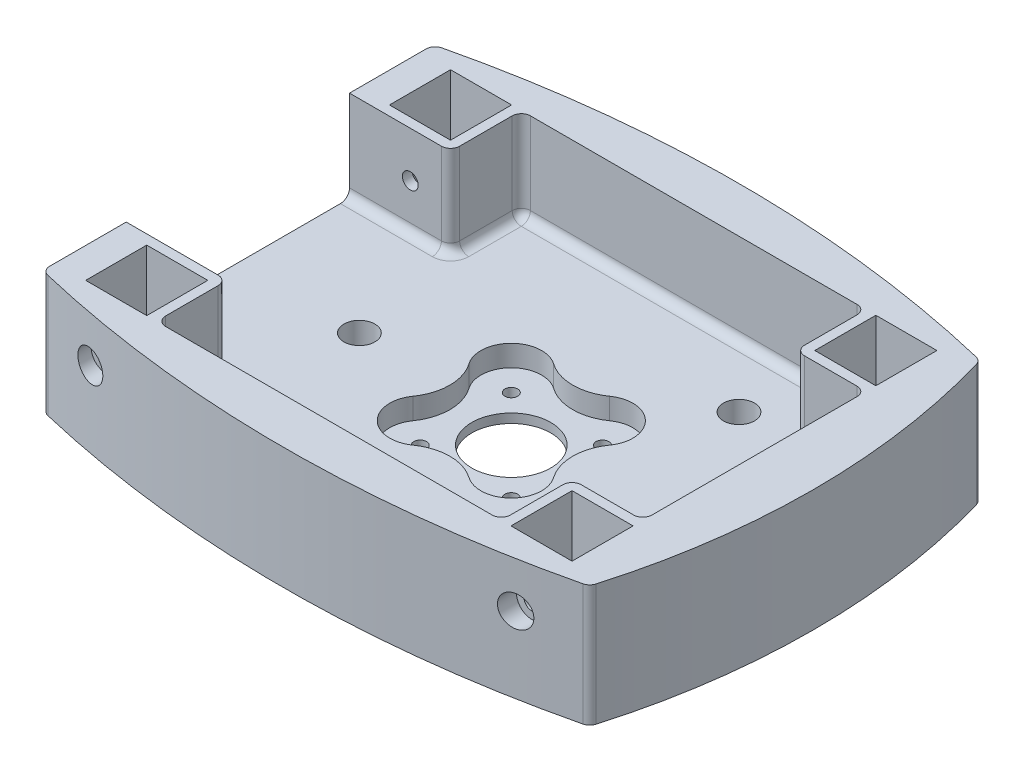
from build123d import *

# Parameters (mm, degrees)
SKETCH1_W           = 20.1
SKETCH1_H           = 20.1
BOSS_EXTRUDE1_DEPTH = 40
SKETCH1_3_R         = 5.1
BOSS_EXTRUDE2_DEPTH = 10
SKETCH1_4_R         = 13
SKETCH1_4_R_2       = 2.1
BOSS_EXTRUDE3_DEPTH = 3
SKETCH2_R           = 5.05
CUT_EXTRUDE1_DEPTH  = 62
SKETCH2_3_R         = 5.05
SKETCH2_3_R_2       = 2.6
BOSS_EXTRUDE5_DEPTH = 26.5
SKETCH2_4_R         = 5.05
SKETCH2_4_R_2       = 2.6
CUT_EXTRUDE2_DEPTH  = 23.3
SKETCH2_5_R         = 5.05
SKETCH2_5_R_2       = 2.6
BOSS_EXTRUDE6_DEPTH = 3.2
CUT_EXTRUDE3_START  = 127.2
SKETCH2_6_R         = 5.05
CUT_EXTRUDE3_DEPTH  = 127.2
BOSS_EXTRUDE7_START = 100
SKETCH2_7_R         = 5.05
SKETCH2_7_R_2       = 2.6
BOSS_EXTRUDE7_DEPTH = 100
CUT_EXTRUDE4_START  = 96.8
SKETCH2_8_R         = 5.05
SKETCH2_8_R_2       = 2.6
CUT_EXTRUDE4_DEPTH  = 96.8
BOSS_EXTRUDE8_START = 76.7
SKETCH2_9_R         = 5.05
SKETCH2_9_R_2       = 2.6
BOSS_EXTRUDE8_DEPTH = 76.7
CUT_EXTRUDE5_START  = 73.5
SKETCH2_10_R        = 5.05
SKETCH2_10_R_2      = 2.6
CUT_EXTRUDE5_DEPTH  = 73.5
SKETCH3_W           = 73.5
SKETCH3_H           = 30
CUT_EXTRUDE6_DEPTH  = 10
FILLET1_R           = 3


with BuildPart() as part:
    # Sketch1 → Boss-Extrude1 (new body)
    with BuildSketch(Plane(origin=(0, 0, 0), x_dir=(1, 0, 0), z_dir=(0, 1, 0))):
        with BuildLine():
            Line((-160, 14.285714286), (-160, -114.285714286))
            ThreePointArc((-160, -114.285714286), (-70, -125.097415446), (20, -114.285714286))
            ThreePointArc((20, -114.285714286), (29.379159313, -50), (20, 14.285714286))
            ThreePointArc((20, 14.285714286), (-70, 25.097415446), (-160, 14.285714286))
        make_face()
        with Locations((-140, 0)):
            Rectangle(SKETCH1_W, SKETCH1_H, mode=Mode.SUBTRACT)
        Rectangle(SKETCH1_W, SKETCH1_H, mode=Mode.SUBTRACT)
        with Locations((-140, -100)):
            Rectangle(SKETCH1_W, SKETCH1_H, mode=Mode.SUBTRACT)
        with Locations((0, -100)):
            Rectangle(SKETCH1_W, SKETCH1_H, mode=Mode.SUBTRACT)
        Polygon((-126.75, 10.05), (-126.75, -13.25), (-150.05, -13.25), (-150.05, -86.75), (-126.75, -86.75), (-126.75, -110.05), (-13.25, -110.05), (-13.25, -86.75), (10.05, -86.75), (10.05, -13.25), (-13.25, -13.25), (-13.25, 10.05), align=None, mode=Mode.SUBTRACT)
    extrude(amount=BOSS_EXTRUDE1_DEPTH)

    # Sketch1<3> → Boss-Extrude2 (add)
    with BuildSketch(Plane(origin=(0, 0, 0), x_dir=(1, 0, 0), z_dir=(0, 1, 0))):
        Polygon((-13.25, 10.05), (-126.75, 10.05), (-126.75, -13.25), (-150.05, -13.25), (-150.05, -86.75), (-126.75, -86.75), (-126.75, -110.05), (-13.25, -110.05), (-13.25, -86.75), (10.05, -86.75), (10.05, -13.25), (-13.25, -13.25), align=None)
        with Locations(Location((-120, -50, 0), (0, 0, 270))):
            Circle(SKETCH1_3_R, mode=Mode.SUBTRACT)
        with BuildLine():
            ThreePointArc((-93.167984839, -59.230769231), (-90.236760582, -50), (-93.167984839, -40.769230769))
            ThreePointArc((-93.167984839, -40.769230769), (-92.071067812, -27.928932188), (-79.230769231, -26.832015161))
            ThreePointArc((-79.230769231, -26.832015161), (-70, -29.763239418), (-60.769230769, -26.832015161))
            ThreePointArc((-60.769230769, -26.832015161), (-47.928932188, -27.928932188), (-46.832015161, -40.769230769))
            ThreePointArc((-46.832015161, -40.769230769), (-49.763239418, -50), (-46.832015161, -59.230769231))
            ThreePointArc((-46.832015161, -59.230769231), (-47.928932188, -72.071067812), (-60.769230769, -73.167984839))
            ThreePointArc((-60.769230769, -73.167984839), (-70, -70.236760582), (-79.230769231, -73.167984839))
            ThreePointArc((-79.230769231, -73.167984839), (-92.071067812, -72.071067812), (-93.167984839, -59.230769231))
        make_face(mode=Mode.SUBTRACT)
        with Locations(Location((-35, -89.95, 0), (0, 0, 270))):
            Circle(SKETCH1_3_R, mode=Mode.SUBTRACT)
        with Locations(Location((-35, -10.05, 0), (0, 0, 270))):
            Circle(SKETCH1_3_R, mode=Mode.SUBTRACT)
    extrude(amount=BOSS_EXTRUDE2_DEPTH)

    # Sketch1<4> → Boss-Extrude3 (add)
    with BuildSketch(Plane(origin=(0, 0, 0), x_dir=(1, 0, 0), z_dir=(0, 1, 0))):
        with BuildLine():
            ThreePointArc((-60.769230769, -73.167984839), (-70, -70.236760582), (-79.230769231, -73.167984839))
            ThreePointArc((-79.230769231, -73.167984839), (-92.071067812, -72.071067812), (-93.167984839, -59.230769231))
            ThreePointArc((-93.167984839, -59.230769231), (-90.236760582, -50), (-93.167984839, -40.769230769))
            ThreePointArc((-93.167984839, -40.769230769), (-92.071067812, -27.928932188), (-79.230769231, -26.832015161))
            ThreePointArc((-79.230769231, -26.832015161), (-70, -29.763239418), (-60.769230769, -26.832015161))
            ThreePointArc((-60.769230769, -26.832015161), (-47.928932188, -27.928932188), (-46.832015161, -40.769230769))
            ThreePointArc((-46.832015161, -40.769230769), (-49.763239418, -50), (-46.832015161, -59.230769231))
            ThreePointArc((-46.832015161, -59.230769231), (-47.928932188, -72.071067812), (-60.769230769, -73.167984839))
        make_face()
        with Locations(Location((-70, -50, 0), (0, 0, 270))):
            Circle(SKETCH1_4_R, mode=Mode.SUBTRACT)
        with Locations(Location((-85, -65, 0), (0, 0, 270))):
            Circle(SKETCH1_4_R_2, mode=Mode.SUBTRACT)
        with Locations(Location((-55, -65, 0), (0, 0, 270))):
            Circle(SKETCH1_4_R_2, mode=Mode.SUBTRACT)
        with Locations(Location((-55, -35, 0), (0, 0, 270))):
            Circle(SKETCH1_4_R_2, mode=Mode.SUBTRACT)
        with Locations(Location((-85, -35, 0), (0, 0, 270))):
            Circle(SKETCH1_4_R_2, mode=Mode.SUBTRACT)
    extrude(amount=BOSS_EXTRUDE3_DEPTH)

    # Sketch2 → Cut-Extrude1 (cut)
    with BuildSketch(Plane.XY.offset(13.25)):
        with Locations((0, 25)):
            Circle(SKETCH2_R)
        with Locations((-140, 25)):
            Circle(SKETCH2_R)
    extrude(amount=-CUT_EXTRUDE1_DEPTH, mode=Mode.SUBTRACT)

    # Sketch2<3> → Boss-Extrude5 (add)
    # profile 1 of 2: a face of its own
    with BuildSketch(Plane.XY.offset(13.25)):
        with Locations((0, 25)):
            Circle(SKETCH2_3_R)
        with Locations((0, 25)):
            Circle(SKETCH2_3_R_2, mode=Mode.SUBTRACT)
    # profile 2 of 2: a face of its own
    with BuildSketch(Plane.XY.offset(13.25)):
        with Locations((-140, 25)):
            Circle(SKETCH2_3_R)
        with Locations((-140, 25)):
            Circle(SKETCH2_3_R_2, mode=Mode.SUBTRACT)
    extrude(amount=-BOSS_EXTRUDE5_DEPTH)

    # Sketch2<4> → Cut-Extrude2 (cut)
    # profile 1 of 2: a face of its own
    with BuildSketch(Plane.XY.offset(13.25)):
        with Locations((0, 25)):
            Circle(SKETCH2_4_R)
        with Locations((0, 25)):
            Circle(SKETCH2_4_R_2, mode=Mode.SUBTRACT)
    # profile 2 of 2: a face of its own
    with BuildSketch(Plane.XY.offset(13.25)):
        with Locations((-140, 25)):
            Circle(SKETCH2_4_R)
        with Locations((-140, 25)):
            Circle(SKETCH2_4_R_2, mode=Mode.SUBTRACT)
    extrude(amount=-CUT_EXTRUDE2_DEPTH, mode=Mode.SUBTRACT)

    # Sketch2<5> → Boss-Extrude6 (add)
    # profile 1 of 2: a face of its own
    with BuildSketch(Plane.XY.offset(13.25)):
        with Locations((0, 25)):
            Circle(SKETCH2_5_R)
        with Locations((0, 25)):
            Circle(SKETCH2_5_R_2, mode=Mode.SUBTRACT)
    # profile 2 of 2: a face of its own
    with BuildSketch(Plane.XY.offset(13.25)):
        with Locations((-140, 25)):
            Circle(SKETCH2_5_R)
        with Locations((-140, 25)):
            Circle(SKETCH2_5_R_2, mode=Mode.SUBTRACT)
    extrude(amount=-BOSS_EXTRUDE6_DEPTH)

    # Sketch2<6> → Cut-Extrude3 (cut)
    with BuildSketch(Plane.XY.offset(13.25).offset(CUT_EXTRUDE3_START)):
        with Locations((0, 25)):
            Circle(SKETCH2_6_R)
        with Locations((-140, 25)):
            Circle(SKETCH2_6_R)
    extrude(amount=-CUT_EXTRUDE3_DEPTH, mode=Mode.SUBTRACT)

    # Sketch2<7> → Boss-Extrude7 (add)
    # profile 1 of 2: a face of its own
    with BuildSketch(Plane.XY.offset(13.25).offset(BOSS_EXTRUDE7_START)):
        with Locations((0, 25)):
            Circle(SKETCH2_7_R)
        with Locations((0, 25)):
            Circle(SKETCH2_7_R_2, mode=Mode.SUBTRACT)
    # profile 2 of 2: a face of its own
    with BuildSketch(Plane.XY.offset(13.25).offset(BOSS_EXTRUDE7_START)):
        with Locations((-140, 25)):
            Circle(SKETCH2_7_R)
        with Locations((-140, 25)):
            Circle(SKETCH2_7_R_2, mode=Mode.SUBTRACT)
    extrude(amount=-BOSS_EXTRUDE7_DEPTH)

    # Sketch2<8> → Cut-Extrude4 (cut)
    # profile 1 of 2: a face of its own
    with BuildSketch(Plane.XY.offset(13.25).offset(CUT_EXTRUDE4_START)):
        with Locations((0, 25)):
            Circle(SKETCH2_8_R)
        with Locations((0, 25)):
            Circle(SKETCH2_8_R_2, mode=Mode.SUBTRACT)
    # profile 2 of 2: a face of its own
    with BuildSketch(Plane.XY.offset(13.25).offset(CUT_EXTRUDE4_START)):
        with Locations((-140, 25)):
            Circle(SKETCH2_8_R)
        with Locations((-140, 25)):
            Circle(SKETCH2_8_R_2, mode=Mode.SUBTRACT)
    extrude(amount=-CUT_EXTRUDE4_DEPTH, mode=Mode.SUBTRACT)

    # Sketch2<9> → Boss-Extrude8 (add)
    # profile 1 of 2: a face of its own
    with BuildSketch(Plane.XY.offset(13.25).offset(BOSS_EXTRUDE8_START)):
        with Locations((0, 25)):
            Circle(SKETCH2_9_R)
        with Locations(Location((0, 25, 0), (0, 0, 180))):
            Circle(SKETCH2_9_R_2, mode=Mode.SUBTRACT)
    # profile 2 of 2: a face of its own
    with BuildSketch(Plane.XY.offset(13.25).offset(BOSS_EXTRUDE8_START)):
        with Locations((-140, 25)):
            Circle(SKETCH2_9_R)
        with Locations(Location((-140, 25, 0), (0, 0, 180))):
            Circle(SKETCH2_9_R_2, mode=Mode.SUBTRACT)
    extrude(amount=-BOSS_EXTRUDE8_DEPTH)

    # Sketch2<10> → Cut-Extrude5 (cut)
    # profile 1 of 4: a face of its own
    with BuildSketch(Plane.XY.offset(13.25).offset(CUT_EXTRUDE5_START)):
        with Locations((-140, 25)):
            Circle(SKETCH2_10_R)
        with Locations((-140, 25)):
            Circle(SKETCH2_10_R_2, mode=Mode.SUBTRACT)
    # profile 2 of 4: a face of its own
    with BuildSketch(Plane.XY.offset(13.25).offset(CUT_EXTRUDE5_START)):
        with Locations((-140, 25)):
            Circle(SKETCH2_10_R_2)
    # profile 3 of 4: a face of its own
    with BuildSketch(Plane.XY.offset(13.25).offset(CUT_EXTRUDE5_START)):
        with Locations((0, 25)):
            Circle(SKETCH2_10_R)
        with Locations((0, 25)):
            Circle(SKETCH2_10_R_2, mode=Mode.SUBTRACT)
    # profile 4 of 4: a face of its own
    with BuildSketch(Plane.XY.offset(13.25).offset(CUT_EXTRUDE5_START)):
        with Locations((0, 25)):
            Circle(SKETCH2_10_R_2)
    extrude(amount=-CUT_EXTRUDE5_DEPTH, mode=Mode.SUBTRACT)

    # Sketch3 → Cut-Extrude6 (cut)
    with BuildSketch(Plane(origin=(-150.05, 0, 0), x_dir=(0, 0, -1), z_dir=(1, 0, 0))):
        with Locations((-50, 25)):
            Rectangle(SKETCH3_W, SKETCH3_H)
    extrude(amount=-CUT_EXTRUDE6_DEPTH, mode=Mode.SUBTRACT)

    # Fillet1
    fillet1_edges = [part.edges().sort_by_distance(p)[0] for p in [
        (10.05, 10, 50),
        (-1.6, 10, 13.25),
        (-13.25, 10, 1.6),
        (-70, 10, -10.05),
        (-143.375, 10, 13.25),
        (-143.375, 10, 86.75),
        (-126.75, 10, 98.4),
        (-70, 10, 110.05),
        (-13.25, 10, 98.4),
        (-1.6, 10, 86.75),
        (-126.75, 10, 1.6),
        (-126.75, 25, 86.75),
        (-126.75, 25, 110.05),
        (-13.25, 25, 110.05),
        (-13.25, 25, 86.75),
        (10.05, 25, 86.75),
        (10.05, 25, 13.25),
        (-13.25, 25, 13.25),
        (-13.25, 25, -10.05),
        (-126.75, 25, -10.05),
        (-126.75, 25, 13.25),
        (20, 20, 114.285714286),
        (-160, 20, 114.285714286),
        (-160, 20, -14.285714286),
        (20, 20, -14.285714286),
    ]]
    fillet(fillet1_edges, radius=FILLET1_R)


solid = part.part
